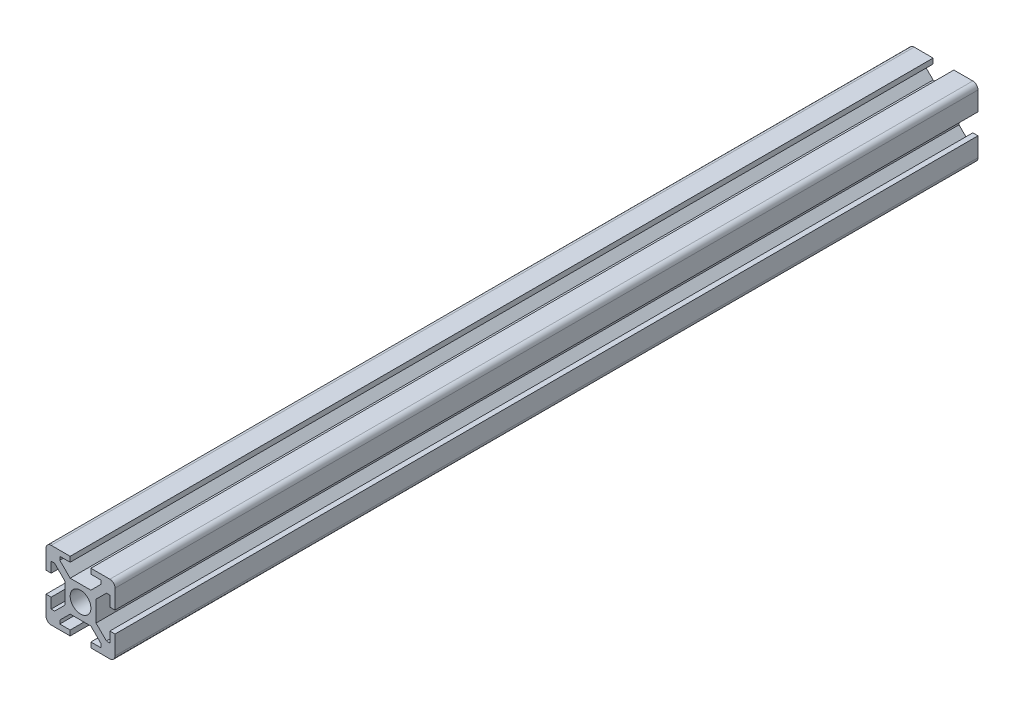
from build123d import *

# Parameters (mm, degrees)
ESQUISSE1_W                  = 20
ESQUISSE1_H                  = 20
EXTRUSION1_DEPTH             = 125
CONG_1_R                     = 1.5
ENL_V_MAT_EXTRU_1_DEPTH      = 251.399680511
R_P_TITION_CIRCULAIRE1_COUNT = 4


with BuildPart() as part:
    # Esquisse1 → Extrusion1 (new, symmetric)
    with BuildSketch(Plane.XY):
        Rectangle(ESQUISSE1_W, ESQUISSE1_H)
    extrude(amount=EXTRUSION1_DEPTH, both=True)

    # Congé1
    cong_1_edges = [part.edges().sort_by_distance(p)[0] for p in [
        (-10, -10, 0),
        (10, -10, 0),
        (-10, 10, 0),
        (10, 10, 0),
    ]]
    fillet(cong_1_edges, radius=CONG_1_R)

    # Esquisse2 → Enlèv. mat.-Extru.1 (cut, through all)
    with BuildSketch(Plane(origin=(0, 0, -125), x_dir=(-1, 0, 0), z_dir=(0, 0, -1))):
        Polygon((-10, 3), (-10, -3), (-8.5, -3), (-8.5, -6), (-7.5, -6), (-4.5, -3), (-4.5, 3), (-7.5, 6), (-8.5, 6), (-8.5, 3), align=None)
    enl_v_mat_extru_1 = extrude(amount=-ENL_V_MAT_EXTRU_1_DEPTH, mode=Mode.SUBTRACT)

    # Répétition circulaire1: Enlèv. mat.-Extru.1 ×4 about axis
    r_p_tition_circulaire1_axis = Axis((0, 0, 9.333809512), (0, 0, -1))
    for i in range(1, R_P_TITION_CIRCULAIRE1_COUNT):
        add(enl_v_mat_extru_1.rotate(r_p_tition_circulaire1_axis, i * 360 / R_P_TITION_CIRCULAIRE1_COUNT), mode=Mode.SUBTRACT)

    # Esquisse5 → Trou taraudé M6x1.01 (revolve, cut)
    with BuildSketch(Plane(origin=(0, 0, -125), x_dir=(0, 1, 0), z_dir=(1, 0, 0))):
        Polygon((0, 0), (0, 31.502151548), (2.5, 30), (2.5, 24), (3, 24), (3, 0), align=None)
    trou_taraud_m6x1_01 = revolve(axis=Axis((0, 0, -131.35), (0, 0, 1)), mode=Mode.SUBTRACT)

    # Symétrie1: Trou taraudé M6x1.01 across plane
    add(trou_taraud_m6x1_01.mirror(Plane.XY), mode=Mode.SUBTRACT)


solid = part.part
